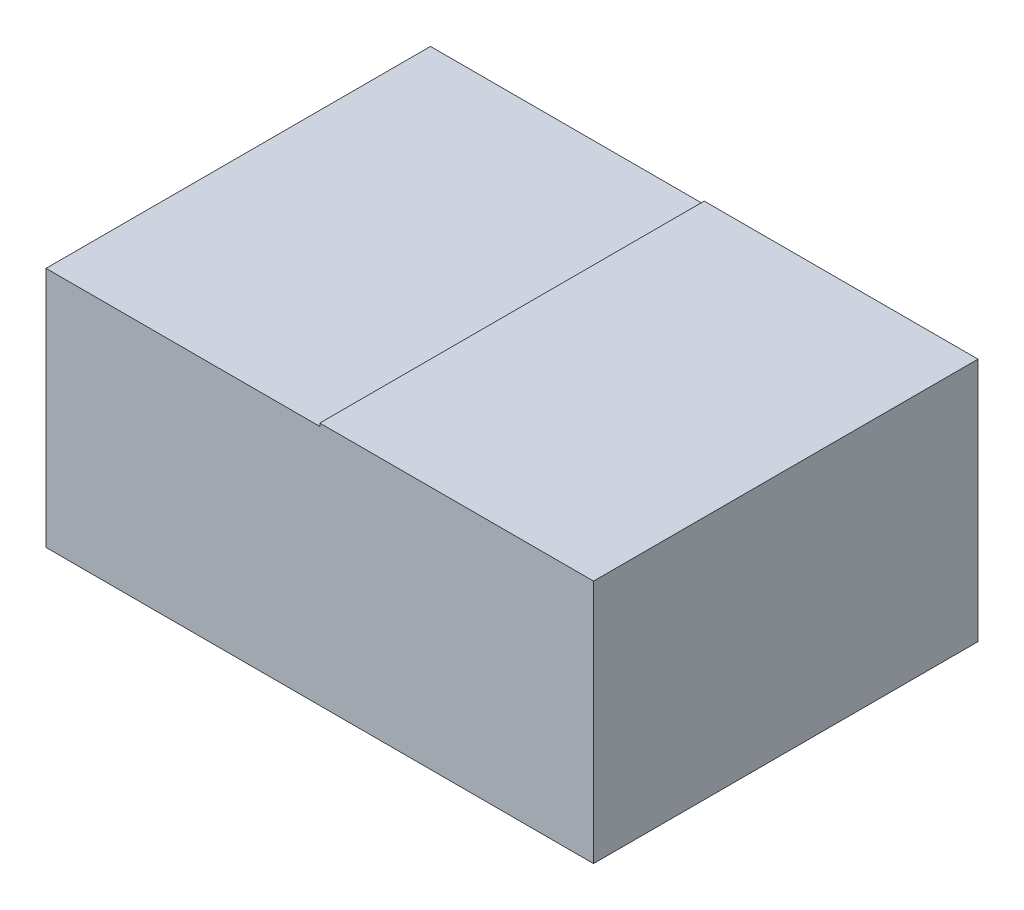
from build123d import *

# Parameters (mm, degrees)
SKETCH1_W           = 18.8
SKETCH1_H           = 13.2
BOSS_EXTRUDE1_DEPTH = 8.4
SKETCH2_W           = 9.4
SKETCH2_H           = 13.2
CUT_EXTRUDE1_DEPTH  = 0.1


with BuildPart() as part:
    # Sketch1 → Boss-Extrude1 (new body)
    with BuildSketch(Plane(origin=(0, 0, 0), x_dir=(1, 0, 0), z_dir=(0, 1, 0))):
        with Locations((9.4, 6.6)):
            Rectangle(SKETCH1_W, SKETCH1_H)
    extrude(amount=BOSS_EXTRUDE1_DEPTH)

    # Sketch2 → Cut-Extrude1 (cut)
    with BuildSketch(Plane(origin=(0, 8.4, 0), x_dir=(1, 0, 0), z_dir=(0, 1, 0))):
        with Locations((4.7, 6.6)):
            Rectangle(SKETCH2_W, SKETCH2_H)
    extrude(amount=-CUT_EXTRUDE1_DEPTH, mode=Mode.SUBTRACT)


solid = part.part
